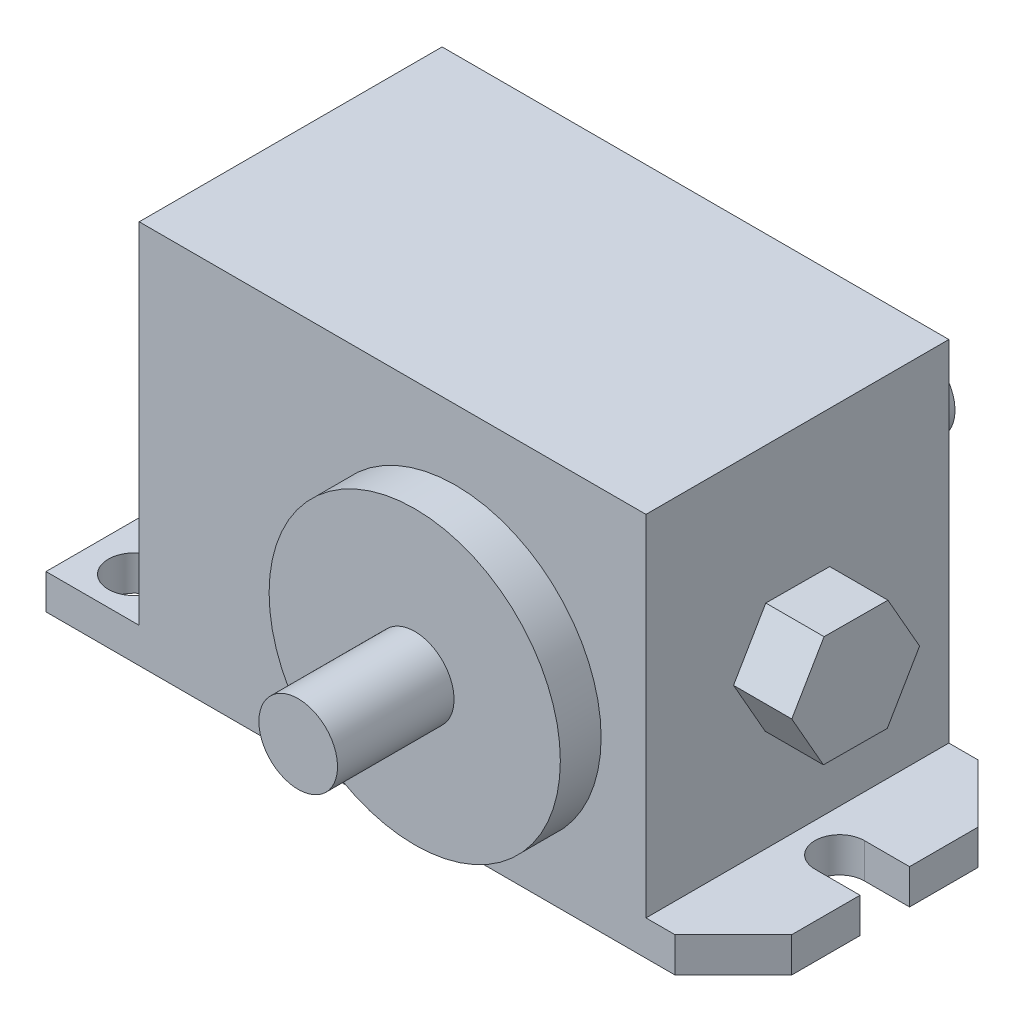
from build123d import *

# Parameters (mm, degrees)
SZKIC1_R                    = 4.5
DODANIE_WYCI_GNI_CIE1_DEPTH = 6
SZKIC2_W                    = 87
SZKIC2_H                    = 52
DODANIE_WYCI_GNI_CIE2_DEPTH = 60
SZKIC3_R                    = 25
DODANIE_WYCI_GNI_CIE3_DEPTH = 7
SZKIC4_R                    = 6.75
DODANIE_WYCI_GNI_CIE4_DEPTH = 20
DODANIE_WYCI_GNI_CIE5_DEPTH = 10


with BuildPart() as part:
    # Szkic1 → Dodanie-wyciągnięcie1 (new body)
    with BuildSketch(Plane(origin=(0, 0, 0), x_dir=(1, 0, 0), z_dir=(0, 1, 0))):
        with BuildLine():
            Line((64, 16), (54, 26))
            Line((54, 26), (-54, 26))
            Line((-54, 26), (-54, -26))
            Line((-54, -26), (54, -26))
            Line((54, -26), (64, -16))
            Line((64, -16), (64, -4.25))
            Line((64, -4.25), (56.25, -4.25))
            ThreePointArc((56.25, -4.25), (52, 0), (56.25, 4.25))
            Line((56.25, 4.25), (64, 4.25))
            Line((64, 4.25), (64, 16))
        make_face()
        with Locations(Location((-46, -18.8, 0), (0, 0, 270))):
            Circle(SZKIC1_R, mode=Mode.SUBTRACT)
        with Locations(Location((-46, 18.8, 0), (0, 0, 270))):
            Circle(SZKIC1_R, mode=Mode.SUBTRACT)
    extrude(amount=DODANIE_WYCI_GNI_CIE1_DEPTH)

    # Szkic2 → Dodanie-wyciągnięcie2 (add)
    with BuildSketch(Plane(origin=(0, 6, 0), x_dir=(1, 0, 0), z_dir=(0, 1, 0))):
        with Locations((5.5, 0)):
            Rectangle(SZKIC2_W, SZKIC2_H)
    extrude(amount=DODANIE_WYCI_GNI_CIE2_DEPTH)

    # Szkic3 → Dodanie-wyciągnięcie3 (add)
    with BuildSketch(Plane(origin=(0, 0, -26), x_dir=(-1, 0, 0), z_dir=(0, 0, -1))):
        with Locations((-16.3, 29)):
            Circle(SZKIC3_R)
    dodanie_wyci_gni_cie3 = extrude(amount=DODANIE_WYCI_GNI_CIE3_DEPTH)

    # Szkic4 → Dodanie-wyciągnięcie4 (add)
    with BuildSketch(Plane(origin=(0, 0, -33), x_dir=(-1, 0, 0), z_dir=(0, 0, -1))):
        with Locations((-16.3, 29)):
            Circle(SZKIC4_R)
    dodanie_wyci_gni_cie4 = extrude(amount=DODANIE_WYCI_GNI_CIE4_DEPTH)

    # Lustro1: Dodanie-wyciągnięcie3, Dodanie-wyciągnięcie4 across plane
    add(dodanie_wyci_gni_cie3.mirror(Plane.XY))
    add(dodanie_wyci_gni_cie4.mirror(Plane.XY))

    # Szkic5 → Dodanie-wyciągnięcie5 (add)
    with BuildSketch(Plane(origin=(49, 0, 0), x_dir=(0, 0, -1), z_dir=(1, 0, 0))):
        Polygon((5.428883431, 23.467919533), (10.969465551, 32.935510732), (5.54058212, 42.467591199), (-5.428883431, 42.532080467), (-10.969465551, 33.064489268), (-5.54058212, 23.532408801), align=None)
    extrude(amount=DODANIE_WYCI_GNI_CIE5_DEPTH)


solid = part.part
